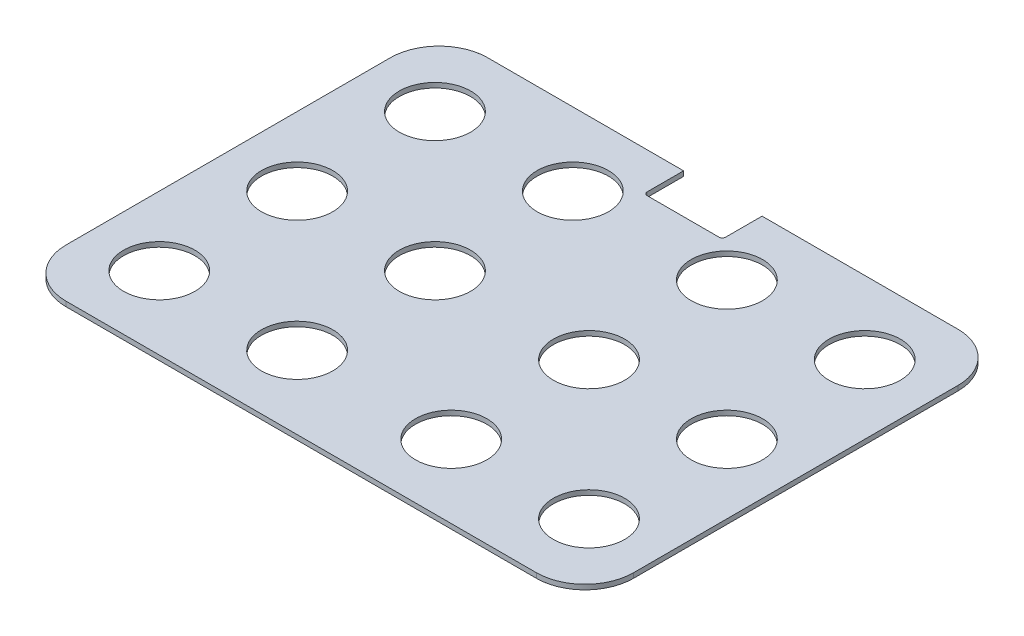
from build123d import *

# Parameters (mm, degrees)
SKETCH_1_W                  = 350
SKETCH_1_H                  = 260
EXTRUDE_1_DEPTH             = 3
FILLET_2_R                  = 30
CUT_EXTRUDE_2_REACH         = 220.023
SKETCH_3_R                  = 22
PATTERN_LINEAR_1_COUNT      = 2
PATTERN_LINEAR_1_PITCH      = 85
PATTERN_LINEAR_1_COUNT_DIR2 = 3
PATTERN_LINEAR_1_PITCH_DIR2 = 85
MIRROR_1_COPY_1_REACH       = 220.023
MIRROR_1_COPY_1_SKETCH_R    = 22
MIRROR_1_COPY_2_REACH       = 220.023
MIRROR_1_COPY_2_SKETCH_R    = 22
MIRROR_1_COPY_3_REACH       = 220.023
MIRROR_1_COPY_3_SKETCH_R    = 22
MIRROR_1_COPY_4_REACH       = 220.023
MIRROR_1_COPY_4_SKETCH_R    = 22
MIRROR_1_COPY_5_REACH       = 220.023
MIRROR_1_COPY_5_SKETCH_R    = 22
CUT_EXTRUDE_3_REACH         = 220.023
SKETCH_4_W                  = 48.4
SKETCH_4_H                  = 24.5
FILLET_3_R                  = 2


with BuildPart() as part:
    # 草圖1 → 填料-伸長1 (new body)
    with BuildSketch(Plane(origin=(0, 0, 0), x_dir=(1, 0, 0), z_dir=(0, 1, 0))):
        Rectangle(SKETCH_1_W, SKETCH_1_H)
    extrude(amount=EXTRUDE_1_DEPTH)

    # 圓角2
    fillet_2_edges = [part.edges().sort_by_distance(p)[0] for p in [
        (175, 1.5, 130),
        (-175, 1.5, 130),
        (-175, 1.5, -130),
        (175, 1.5, -130),
    ]]
    fillet(fillet_2_edges, radius=FILLET_2_R)

    # 草圖3 → 除料-伸長2 (cut, up to next)
    with BuildSketch(Plane(origin=(0, 3, 0), x_dir=(1, 0, 0), z_dir=(0, 1, 0)), mode=Mode.PRIVATE) as cut_extrude_2_sk1:
        with Locations(Location((-132.5, 85, 0), (0, 0, 270))):
            Circle(SKETCH_3_R)
    cut_extrude_2_tool1 = extrude(cut_extrude_2_sk1.sketch, amount=-CUT_EXTRUDE_2_REACH, mode=Mode.PRIVATE) & part.part
    cut_extrude_2 = cut_extrude_2_tool1.solids().sort_by_distance((-132.5, 3, -85))[0]
    add(cut_extrude_2, mode=Mode.SUBTRACT)

    # 直線複製排列1: Cut-Extrude 2 2 × 3
    with Locations(*[(i * PATTERN_LINEAR_1_PITCH, 0, j * PATTERN_LINEAR_1_PITCH_DIR2) for i in range(PATTERN_LINEAR_1_COUNT) for j in range(PATTERN_LINEAR_1_COUNT_DIR2) if (i, j) != (0, 0)]):
        add(cut_extrude_2, mode=Mode.SUBTRACT)

    # 鏡射1: 除料-伸長2 across plane
    add(cut_extrude_2.mirror(Plane(origin=(0, 0, 0), x_dir=(0, 0, 1), z_dir=(1, 0, 0))), mode=Mode.SUBTRACT)

    # 鏡射1 copy 1 sketch → 鏡射1 copy 1 (cut, up to next)
    with BuildSketch(Plane(origin=(0, 3, 85), x_dir=(-1, 0, 0), z_dir=(0, 1, 0)), mode=Mode.PRIVATE) as mirror_1_copy_1_sk1:
        with Locations((-132.5, -85)):
            Circle(MIRROR_1_COPY_1_SKETCH_R)
    mirror_1_copy_1_tool1 = extrude(mirror_1_copy_1_sk1.sketch, amount=-MIRROR_1_COPY_1_REACH, mode=Mode.PRIVATE) & part.part
    add(mirror_1_copy_1_tool1.solids().sort_by_distance((132.5, 3, 0))[0], mode=Mode.SUBTRACT)

    # 鏡射1 copy 2 sketch → 鏡射1 copy 2 (cut, up to next)
    with BuildSketch(Plane(origin=(0, 3, 170), x_dir=(-1, 0, 0), z_dir=(0, 1, 0)), mode=Mode.PRIVATE) as mirror_1_copy_2_sk1:
        with Locations((-132.5, -85)):
            Circle(MIRROR_1_COPY_2_SKETCH_R)
    mirror_1_copy_2_tool1 = extrude(mirror_1_copy_2_sk1.sketch, amount=-MIRROR_1_COPY_2_REACH, mode=Mode.PRIVATE) & part.part
    add(mirror_1_copy_2_tool1.solids().sort_by_distance((132.5, 3, 85))[0], mode=Mode.SUBTRACT)

    # 鏡射1 copy 3 sketch → 鏡射1 copy 3 (cut, up to next)
    with BuildSketch(Plane(origin=(-85, 3, 0), x_dir=(-1, 0, 0), z_dir=(0, 1, 0)), mode=Mode.PRIVATE) as mirror_1_copy_3_sk1:
        with Locations((-132.5, -85)):
            Circle(MIRROR_1_COPY_3_SKETCH_R)
    mirror_1_copy_3_tool1 = extrude(mirror_1_copy_3_sk1.sketch, amount=-MIRROR_1_COPY_3_REACH, mode=Mode.PRIVATE) & part.part
    add(mirror_1_copy_3_tool1.solids().sort_by_distance((47.5, 3, -85))[0], mode=Mode.SUBTRACT)

    # 鏡射1 copy 4 sketch → 鏡射1 copy 4 (cut, up to next)
    with BuildSketch(Plane(origin=(-85, 3, 85), x_dir=(-1, 0, 0), z_dir=(0, 1, 0)), mode=Mode.PRIVATE) as mirror_1_copy_4_sk1:
        with Locations((-132.5, -85)):
            Circle(MIRROR_1_COPY_4_SKETCH_R)
    mirror_1_copy_4_tool1 = extrude(mirror_1_copy_4_sk1.sketch, amount=-MIRROR_1_COPY_4_REACH, mode=Mode.PRIVATE) & part.part
    add(mirror_1_copy_4_tool1.solids().sort_by_distance((47.5, 3, 0))[0], mode=Mode.SUBTRACT)

    # 鏡射1 copy 5 sketch → 鏡射1 copy 5 (cut, up to next)
    with BuildSketch(Plane(origin=(-85, 3, 170), x_dir=(-1, 0, 0), z_dir=(0, 1, 0)), mode=Mode.PRIVATE) as mirror_1_copy_5_sk1:
        with Locations((-132.5, -85)):
            Circle(MIRROR_1_COPY_5_SKETCH_R)
    mirror_1_copy_5_tool1 = extrude(mirror_1_copy_5_sk1.sketch, amount=-MIRROR_1_COPY_5_REACH, mode=Mode.PRIVATE) & part.part
    add(mirror_1_copy_5_tool1.solids().sort_by_distance((47.5, 3, 85))[0], mode=Mode.SUBTRACT)

    # 草圖4 → 除料-伸長3 (cut, up to next)
    with BuildSketch(Plane(origin=(0, 3, 0), x_dir=(1, 0, 0), z_dir=(0, 1, 0)), mode=Mode.PRIVATE) as cut_extrude_3_sk1:
        with Locations((0, 117.75)):
            Rectangle(SKETCH_4_W, SKETCH_4_H)
    cut_extrude_3_tool1 = extrude(cut_extrude_3_sk1.sketch, amount=-CUT_EXTRUDE_3_REACH, mode=Mode.PRIVATE) & part.part
    add(cut_extrude_3_tool1.solids().sort_by_distance((0, 3, -117.75))[0], mode=Mode.SUBTRACT)

    # 圓角3
    fillet_3_edges = [part.edges().sort_by_distance(p)[0] for p in [
        (-24.2, 1.5, -105.5),
        (24.2, 1.5, -105.5),
    ]]
    fillet(fillet_3_edges, radius=FILLET_3_R)


solid = part.part
